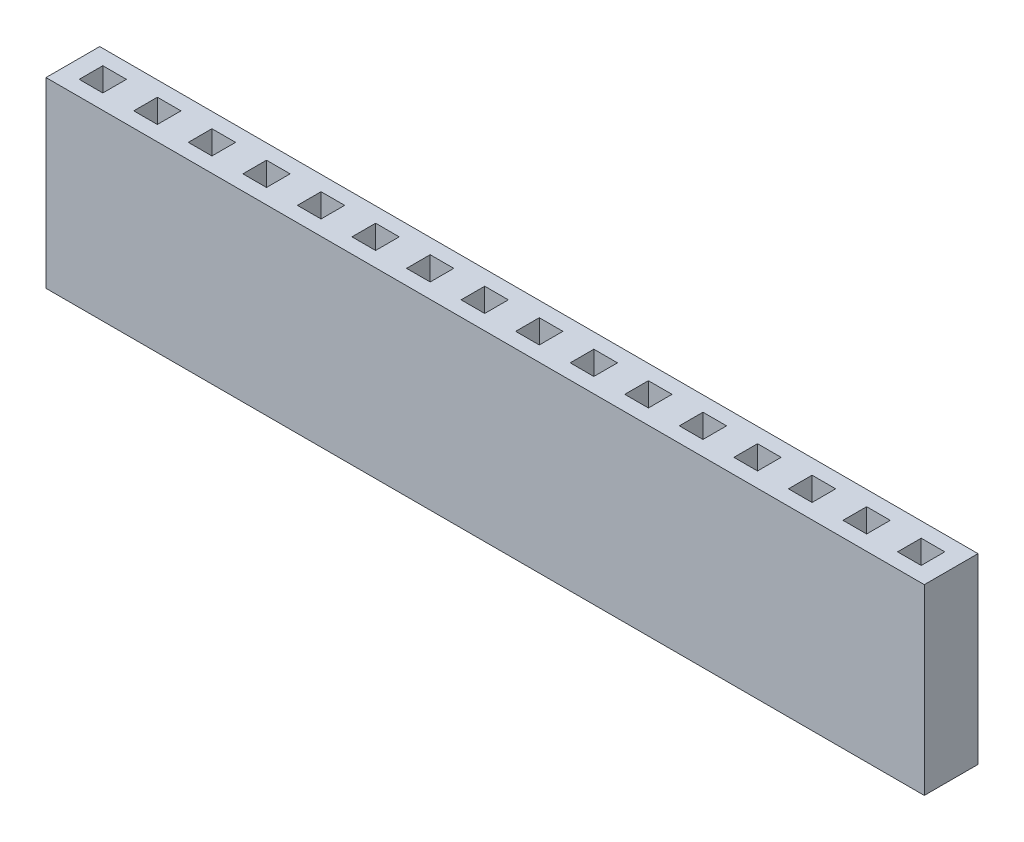
from build123d import *

# Parameters (mm, degrees)
SKETCH1_W           = 40.89
SKETCH1_H           = 8.5
BOSS_EXTRUDE1_DEPTH = 1.25
SKETCH2_W           = 1.1
SKETCH2_H           = 1.1
CUT_EXTRUDE1_DEPTH  = 42.782826616


with BuildPart() as part:
    # Sketch1 → Boss-Extrude1 (new, symmetric)
    with BuildSketch(Plane.XY):
        with Locations((20.445, 4.25)):
            Rectangle(SKETCH1_W, SKETCH1_H)
    extrude(amount=BOSS_EXTRUDE1_DEPTH, both=True)

    # Sketch2 → Cut-Extrude1 (cut, through all)
    with BuildSketch(Plane.XZ):
        with Locations((3.935, 0)):
            Rectangle(SKETCH2_W, SKETCH2_H)
        with Locations((1.395, 0)):
            Rectangle(SKETCH2_W, SKETCH2_H)
        with Locations((6.475, 0)):
            Rectangle(SKETCH2_W, SKETCH2_H)
        with Locations((9.015, 0)):
            Rectangle(SKETCH2_W, SKETCH2_H)
        with Locations((11.555, 0)):
            Rectangle(SKETCH2_W, SKETCH2_H)
        with Locations((14.095, 0)):
            Rectangle(SKETCH2_W, SKETCH2_H)
        with Locations((16.635, 0)):
            Rectangle(SKETCH2_W, SKETCH2_H)
        with Locations((19.175, 0)):
            Rectangle(SKETCH2_W, SKETCH2_H)
        with Locations((21.715, 0)):
            Rectangle(SKETCH2_W, SKETCH2_H)
        with Locations((24.255, 0)):
            Rectangle(SKETCH2_W, SKETCH2_H)
        with Locations((26.795, 0)):
            Rectangle(SKETCH2_W, SKETCH2_H)
        with Locations((29.335, 0)):
            Rectangle(SKETCH2_W, SKETCH2_H)
        with Locations((31.875, 0)):
            Rectangle(SKETCH2_W, SKETCH2_H)
        with Locations((34.415, 0)):
            Rectangle(SKETCH2_W, SKETCH2_H)
        with Locations((36.955, 0)):
            Rectangle(SKETCH2_W, SKETCH2_H)
        with Locations((39.495, 0)):
            Rectangle(SKETCH2_W, SKETCH2_H)
    extrude(amount=-CUT_EXTRUDE1_DEPTH, mode=Mode.SUBTRACT)


solid = part.part
